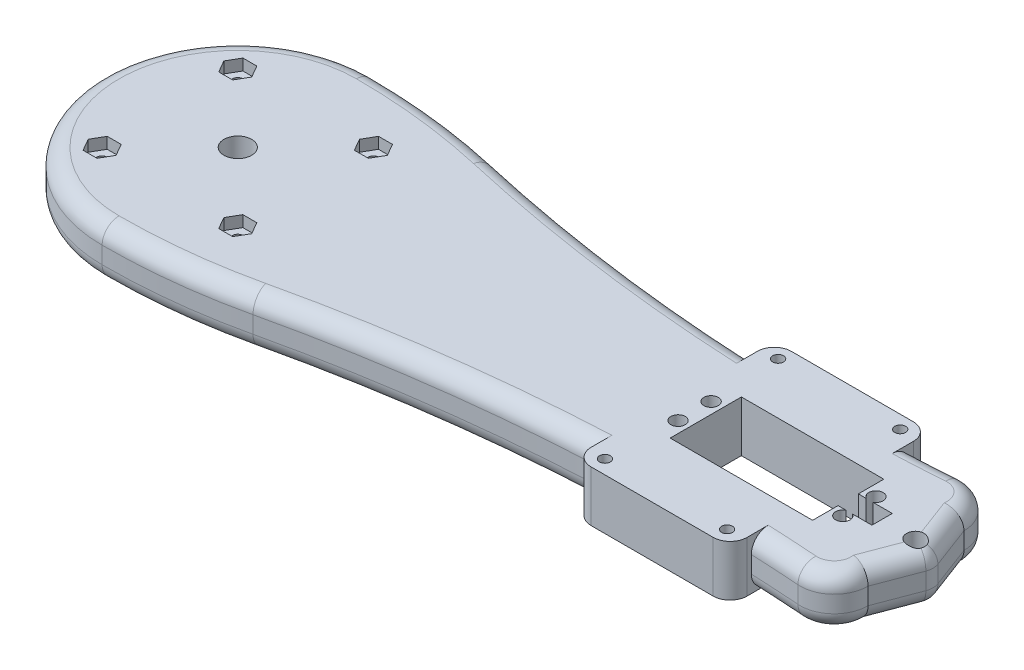
from build123d import *

# Parameters (mm, degrees)
SALIENTE_EXTRUIR1_DEPTH = 15
REDONDEO2_R             = 10
CROQUIS2_R              = 1.6
CROQUIS2_R_2            = 4.09
CORTAR_EXTRUIR1_DEPTH   = 205.511613362
SALIENTE_EXTRUIR2_DEPTH = 15
SALIENTE_EXTRUIR3_START = -15
SALIENTE_EXTRUIR3_DEPTH = 15
REDONDEO10_R            = 5
REDONDEO11_R            = 5
CORTAR_EXTRUIR3_REACH   = 211.404
CROQUIS12_R             = 1.6
CORTAR_EXTRUIR4_REACH   = 211.404
CROQUIS13_R             = 2.675
CROQUIS14_R             = 2.125
CORTAR_EXTRUIR5_DEPTH   = 210.403915921
CORTAR_EXTRUIR6_DEPTH   = 3.32


with BuildPart() as part:
    # Croquis1 → Saliente-Extruir1 (new body)
    with BuildSketch(Plane(origin=(0, 0, 0), x_dir=(1, 0, 0), z_dir=(0, 1, 0))):
        with BuildLine():
            Line((200, -25), (200, 25))
            ThreePointArc((200, 25), (119.582993239, 23.895611266), (40, 35.5))
            ThreePointArc((40, 35.5), (20.126164563, 38.871462778), (0, 40))
            ThreePointArc((0, 40), (-40, 0), (0, -40))
            ThreePointArc((0, -40), (20.126164563, -38.871462778), (40, -35.5))
            ThreePointArc((40, -35.5), (119.582993239, -23.895611266), (200, -25))
        make_face()
    extrude(amount=SALIENTE_EXTRUIR1_DEPTH)

    # Redondeo2
    redondeo2_edges = [part.edges().sort_by_distance(p)[0] for p in [
        (200, 7.5, -25),
        (200, 7.5, 25),
    ]]
    fillet(redondeo2_edges, radius=REDONDEO2_R)

    # Croquis2 → Cortar-Extruir1 (cut, through all)
    with BuildSketch(Plane.XZ):
        with Locations(Location((-20, 20, 0), (0, 0, 270))):
            Circle(CROQUIS2_R)
        with Locations(Location((20, 20, 0), (0, 0, 270))):
            Circle(CROQUIS2_R)
        with Locations(Location((0, 0, 0), (0, 0, 270))):
            Circle(CROQUIS2_R_2)
        with Locations(Location((20, -20, 0), (0, 0, 270))):
            Circle(CROQUIS2_R)
        with Locations(Location((-20, -20, 0), (0, 0, 270))):
            Circle(CROQUIS2_R)
        Polygon((138, 10.5), (180, 10.5), (180, 3), (190, 3), (190, -3), (180, -3), (180, -10.5), (138, -10.5), align=None)
    extrude(amount=-CORTAR_EXTRUIR1_DEPTH, mode=Mode.SUBTRACT)

    # Croquis3 → Saliente-Extruir2 (add, through all)
    with BuildSketch(Plane.XZ):
        with BuildLine():
            Line((200, 14.140560817), (204.676997318, 1.767963826))
            ThreePointArc((204.676997318, 1.767963826), (205, 0), (204.676997318, -1.767963826))
            Line((204.676997318, -1.767963826), (200, -14.140560817))
            Line((200, -14.140560817), (200, -5))
            ThreePointArc((200, -5), (195, 0), (200, 5))
            Line((200, 5), (200, 14.140560817))
        make_face()
    extrude(amount=-SALIENTE_EXTRUIR2_DEPTH)

    # Croquis6 → Saliente-Extruir3 (add)
    with BuildSketch(Plane(origin=(0, 15, 0), x_dir=(1, 0, 0), z_dir=(0, 1, 0)).offset(SALIENTE_EXTRUIR3_START)):
        with BuildLine():
            Line((174.7, 23.276259909), (174.7, 29.516259909))
            Line((174.7, 29.516259909), (128.7, 29.516259909))
            Line((128.7, 29.516259909), (128.7, 23.379580458))
            ThreePointArc((128.7, 23.379580458), (151.698829591, 22.80683483), (174.7, 23.276259909))
        make_face()
        with BuildLine():
            Line((128.7, -29.516259909), (128.7, -23.379580458))
            ThreePointArc((128.7, -23.379580458), (151.698829591, -22.80683483), (174.7, -23.276259909))
            Line((174.7, -23.276259909), (174.7, -29.516259909))
            Line((174.7, -29.516259909), (128.7, -29.516259909))
        make_face()
    extrude(amount=SALIENTE_EXTRUIR3_DEPTH)

    # Redondeo10
    redondeo10_edges = [part.edges().sort_by_distance(p)[0] for p in [
        (84.082407704, 0, -27.481488658),
        (84.082407704, 15, -27.481488658),
        (181.994223287, 0, 23.643092103),
        (181.994223287, 15, 23.643092103),
        (20.126164563, 15, -38.871462778),
        (181.994223287, 0, -23.643092103),
        (196.812641581, 0, -21.460937494),
        (196.812641581, 0, 21.460937494),
        (181.994223287, 15, -23.643092103),
        (196.812641581, 15, -21.460937494),
        (196.812641581, 15, 21.460937494),
        (-40, 15, 0),
        (20.126164563, 15, 38.871462778),
        (-40, 0, 0),
        (20.126164563, 0, -38.871462778),
        (84.082407704, 0, 27.481488658),
        (202.338498659, 0, -7.954262321),
        (205, 0, 0),
        (202.338498659, 0, 7.954262321),
        (202.338498659, 15, 7.954262321),
        (205, 15, 0),
        (20.126164563, 0, 38.871462778),
        (202.338498659, 15, -7.954262321),
        (84.082407704, 15, 27.481488658),
    ]]
    fillet(redondeo10_edges, radius=REDONDEO10_R)

    # Redondeo11
    redondeo11_edges = [part.edges().sort_by_distance(p)[0] for p in [
        (128.7, 7.5, -29.516259909),
        (174.7, 7.5, -29.516259909),
        (174.7, 7.5, 29.516259909),
        (128.7, 7.5, 29.516259909),
    ]]
    fillet(redondeo11_edges, radius=REDONDEO11_R)

    # Croquis12 → Cortar-Extruir3 (cut, up to next)
    with BuildSketch(Plane.XZ, mode=Mode.PRIVATE) as cortar_extruir3_sk1:
        with Locations(Location((133.69, 25.416259909, 0), (0, 0, 270))):
            Circle(CROQUIS12_R)
    cortar_extruir3_tool1 = extrude(cortar_extruir3_sk1.sketch, amount=-CORTAR_EXTRUIR3_REACH, mode=Mode.PRIVATE) & part.part
    # Croquis12 → Cortar-Extruir3 (cut, up to next)
    with BuildSketch(Plane.XZ, mode=Mode.PRIVATE) as cortar_extruir3_sk2:
        with Locations(Location((169.69, 25.416259909, 0), (0, 0, 270))):
            Circle(CROQUIS12_R)
    cortar_extruir3_tool2 = extrude(cortar_extruir3_sk2.sketch, amount=-CORTAR_EXTRUIR3_REACH, mode=Mode.PRIVATE) & part.part
    # Croquis12 → Cortar-Extruir3 (cut, up to next)
    with BuildSketch(Plane.XZ, mode=Mode.PRIVATE) as cortar_extruir3_sk3:
        with Locations(Location((133.69, -25.636259909, 0), (0, 0, 270))):
            Circle(CROQUIS12_R)
    cortar_extruir3_tool3 = extrude(cortar_extruir3_sk3.sketch, amount=-CORTAR_EXTRUIR3_REACH, mode=Mode.PRIVATE) & part.part
    # Croquis12 → Cortar-Extruir3 (cut, up to next)
    with BuildSketch(Plane.XZ, mode=Mode.PRIVATE) as cortar_extruir3_sk4:
        with Locations(Location((169.69, -25.636259909, 0), (0, 0, 270))):
            Circle(CROQUIS12_R)
    cortar_extruir3_tool4 = extrude(cortar_extruir3_sk4.sketch, amount=-CORTAR_EXTRUIR3_REACH, mode=Mode.PRIVATE) & part.part
    add(cortar_extruir3_tool1.solids().sort_by_distance((133.69, 0, 25.41626))[0], mode=Mode.SUBTRACT)
    add(cortar_extruir3_tool2.solids().sort_by_distance((169.69, 0, 25.41626))[0], mode=Mode.SUBTRACT)
    add(cortar_extruir3_tool3.solids().sort_by_distance((133.69, 0, -25.63626))[0], mode=Mode.SUBTRACT)
    add(cortar_extruir3_tool4.solids().sort_by_distance((169.69, 0, -25.63626))[0], mode=Mode.SUBTRACT)

    # Croquis13 → Cortar-Extruir4 (cut, up to next)
    with BuildSketch(Plane.XZ, mode=Mode.PRIVATE) as cortar_extruir4_sk1:
        with Locations(Location((199.87, 0, 0), (0, 0, 251.898264737))):
            Circle(CROQUIS13_R)
    cortar_extruir4_tool1 = extrude(cortar_extruir4_sk1.sketch, amount=-CORTAR_EXTRUIR4_REACH, mode=Mode.PRIVATE) & part.part
    add(cortar_extruir4_tool1.solids().sort_by_distance((199.87, 0, 0))[0], mode=Mode.SUBTRACT)

    # Croquis14 → Cortar-Extruir5 (cut, through all)
    with BuildSketch(Plane(origin=(0, 15, 0), x_dir=(1, 0, 0), z_dir=(0, 1, 0))):
        with Locations((183.3, 4.875)):
            Circle(CROQUIS14_R)
        with Locations((183.3, -4.875)):
            Circle(CROQUIS14_R)
        with Locations(Location((134.7, 4.875, 0), (0, 0, 270))):
            Circle(CROQUIS14_R)
        with Locations(Location((134.7, -4.875, 0), (0, 0, 270))):
            Circle(CROQUIS14_R)
    extrude(amount=-CORTAR_EXTRUIR5_DEPTH, mode=Mode.SUBTRACT)

    # Croquis15 → Cortar-Extruir6 (cut)
    with BuildSketch(Plane(origin=(0, 15, 0), x_dir=(1, 0, 0), z_dir=(0, 1, 0))):
        Polygon((-15.889266083, 20), (-17.944633042, 23.56), (-22.055366958, 23.56), (-24.110733917, 20), (-22.055366958, 16.44), (-17.944633042, 16.44), align=None)
        Polygon((22.055366958, 23.56), (17.944633042, 23.56), (15.889266083, 20), (17.944633042, 16.44), (22.055366958, 16.44), (24.110733917, 20), align=None)
        Polygon((24.110733917, -20), (22.055366958, -16.44), (17.944633042, -16.44), (15.889266083, -20), (17.944633042, -23.56), (22.055366958, -23.56), align=None)
        Polygon((-15.889266083, -20), (-17.944633042, -16.44), (-22.055366958, -16.44), (-24.110733917, -20), (-22.055366958, -23.56), (-17.944633042, -23.56), align=None)
    extrude(amount=-CORTAR_EXTRUIR6_DEPTH, mode=Mode.SUBTRACT)


solid = part.part
